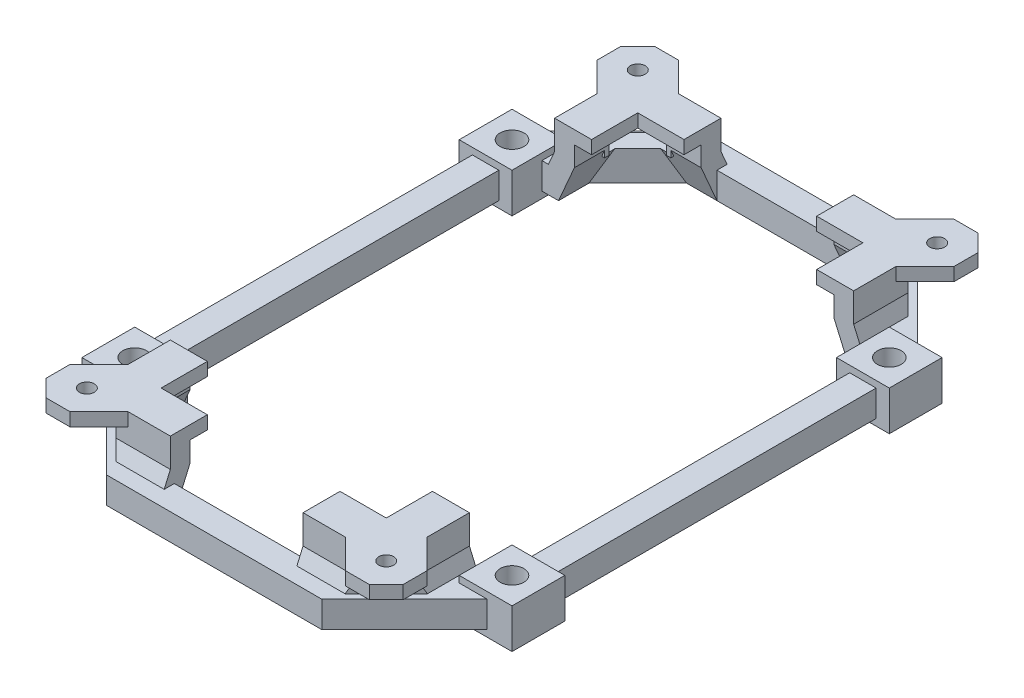
from build123d import *

# Parameters (mm, degrees)
BOSS_EXTRUDE1_DEPTH            = 8
BOSS_EXTRUDE2_DEPTH            = 2
BOSS_EXTRUDE3_DEPTH            = 9.05
SKETCH4_R                      = 2.25
BOSS_EXTRUDE4_DEPTH            = 4
CUT_EXTRUDE1_REACH             = 89.395
SKETCH5_W                      = 12.364675298
SKETCH5_H                      = 8
CUT_EXTRUDE1_DIRECTION_2_DEPTH = 88.395228364
CUT_EXTRUDE2_DEPTH             = 9.171573
CUT_EXTRUDE3_REACH             = 115.505
SKETCH8_W                      = 3.39411255
SKETCH8_H                      = 9.05
CUT_EXTRUDE3_DIRECTION_2_REACH = 115.505
BOSS_EXTRUDE5_DEPTH            = 16.456854
CUT_EXTRUDE4_DEPTH             = 114.504844196
SKETCH12_R                     = 3.6
CUT_EXTRUDE5_DEPTH             = 114.645358602
BOSS_EXTRUDE6_START            = 2
SKETCH13_W                     = 16
SKETCH13_H                     = 16
SKETCH13_R                     = 3.6
BOSS_EXTRUDE6_DEPTH            = 2
CUT_EXTRUDE6_REACH             = 182.475
CUT_EXTRUDE6_DIRECTION_2_DEPTH = 15


with BuildPart() as part:
    # Sketch1 → Boss-Extrude1 (new body)
    with BuildSketch(Plane(origin=(0, 0, 0), x_dir=(1, 0, 0), z_dir=(0, 1, 0))):
        Polygon((-53.15, 0), (-61.15, 0), (-61.15, -49.15), (-65.15, -49.15), (-65.15, -65.15), (-57.635281374, -65.15), (-32.585281374, -90.2), (0, -90.2), (0, -82.2), (-20.1, -82.2), (-20.1, -77.4), (-34.071572875, -77.4), (-39.3, -72.171572875), (-39.3, -58.2), (-49.15, -58.2), (-49.15, -49.15), (-53.15, -49.15), align=None)
    extrude(amount=BOSS_EXTRUDE1_DEPTH)

    # Sketch2 → Boss-Extrude2 (add)
    with BuildSketch(Plane.XZ):
        Polygon((-49.15, 58.2), (-49.15, 49.15), (-65.15, 49.15), (-65.15, 65.15), (-49.15, 65.15), align=None)
    extrude(amount=BOSS_EXTRUDE2_DEPTH)

    # Sketch3 → Boss-Extrude3 (add)
    with BuildSketch(Plane(origin=(0, 8, 0), x_dir=(1, 0, 0), z_dir=(0, 1, 0))):
        Polygon((-39.3, -58.2), (-45.3, -58.2), (-45.3, -74.656854249), (-36.556854249, -83.4), (-20.1, -83.4), (-20.1, -77.4), (-34.071572875, -77.4), (-39.3, -72.171572875), align=None)
    extrude(amount=BOSS_EXTRUDE3_DEPTH)

    # Sketch4 → Boss-Extrude4 (add)
    with BuildSketch(Plane(origin=(0, 17.05, 0), x_dir=(1, 0, 0), z_dir=(0, 1, 0))):
        Polygon((-45.3, -58.2), (-34.1, -58.2), (-34.1, -72.2), (-20.1, -72.2), (-20.1, -83.4), (-32.925631329, -83.4), (-41.723475836, -92.197844507), (-48.972213178, -92.197844507), (-54.097844507, -87.072213178), (-54.097844507, -79.823475836), (-45.3, -71.025631329), align=None)
        with Locations(Location((-45.347844507, -83.447844507, 0), (0, 0, 270))):
            Circle(SKETCH4_R, mode=Mode.SUBTRACT)
    extrude(amount=BOSS_EXTRUDE4_DEPTH)

    # Sketch5 → Cut-Extrude1 (cut, up to next)
    with BuildSketch(Plane(origin=(-59.978427125, 0, 59.978427125), x_dir=(0.7071067811865475, 0, 0.7071067811865477), z_dir=(-0.7071067811865477, 0, 0.7071067811865475)), mode=Mode.PRIVATE) as cut_extrude1_sk1:
        with Locations((26.940768363, 13.05)):
            Rectangle(SKETCH5_W, SKETCH5_H)
    cut_extrude1_tool1 = extrude(cut_extrude1_sk1.sketch, amount=-CUT_EXTRUDE1_REACH, mode=Mode.PRIVATE) & part.part
    add(cut_extrude1_tool1.solids().sort_by_distance((-40.928427, 13.05, 79.028427))[0], mode=Mode.SUBTRACT)

    # Sketch5 → Cut-Extrude1 direction 2 (cut)
    with BuildSketch(Plane(origin=(-59.978427125, 0, 59.978427125), x_dir=(0.7071067811865475, 0, 0.7071067811865477), z_dir=(-0.7071067811865477, 0, 0.7071067811865475))):
        with Locations((26.940768363, 13.05)):
            Rectangle(SKETCH5_W, SKETCH5_H)
    extrude(amount=CUT_EXTRUDE1_DIRECTION_2_DEPTH, mode=Mode.SUBTRACT)

    # Sketch6 → Cut-Extrude2 (cut)
    with BuildSketch(Plane(origin=(-20.1, 0, 0), x_dir=(0, 0, -1), z_dir=(1, 0, 0))):
        Polygon((-82.2, 0), (-77.4, 11.05), (-77.4, 0), align=None)
    cut_extrude2 = extrude(amount=-CUT_EXTRUDE2_DEPTH, mode=Mode.SUBTRACT)

    # Mirror1: Cut-Extrude2 across plane
    add(cut_extrude2.mirror(Plane(origin=(19.05, 0, 19.05), x_dir=(-0.7071067811865477, 0, 0.7071067811865474), z_dir=(0.7071067811865476, 0, 0.7071067811865476))), mode=Mode.SUBTRACT)

    # Cut-Extrude3: up to this face of the body (flat: up to its plane)
    cut_extrude3_end = Plane(part.part.faces().sort_by_distance((-41.7, 5.525, 62.7857865))[0])
    # Sketch8 → Cut-Extrude3 (cut, up to the picked face)
    with BuildSketch(Plane(origin=(19.05, 0, 19.05), x_dir=(0.7071067811865476, 0, -0.7071067811865476), z_dir=(0.7071067811865476, 0, 0.7071067811865476)), mode=Mode.PRIVATE) as cut_extrude3_sk1:
        with Locations((-77.125248815, 4.525)):
            Rectangle(SKETCH8_W, SKETCH8_H)
    cut_extrude3_tool1 = split(extrude(cut_extrude3_sk1.sketch, amount=-CUT_EXTRUDE3_REACH, mode=Mode.PRIVATE), bisect_by=cut_extrude3_end, keep=Keep.BOTH, mode=Mode.PRIVATE)
    add(cut_extrude3_tool1.solids().sort_by(Axis((-35.485786, 4.525, 73.585786), (-0.7071067811865476, 0, -0.7071067811865476)))[0], mode=Mode.SUBTRACT)

    # Cut-Extrude3 direction 2: up to this face of the body (flat: up to its plane)
    cut_extrude3_direction_2_end = Plane(part.part.faces().sort_by_distance((-24.6857865, 5.525, 79.8))[0])
    # Sketch8 → Cut-Extrude3 direction 2 (cut, up to the picked face)
    with BuildSketch(Plane(origin=(19.05, 0, 19.05), x_dir=(0.7071067811865476, 0, -0.7071067811865476), z_dir=(0.7071067811865476, 0, 0.7071067811865476)), mode=Mode.PRIVATE) as cut_extrude3_direction_2_sk1:
        with Locations((-77.125248815, 4.525)):
            Rectangle(SKETCH8_W, SKETCH8_H)
    cut_extrude3_direction_2_tool1 = split(extrude(cut_extrude3_direction_2_sk1.sketch, amount=CUT_EXTRUDE3_DIRECTION_2_REACH, mode=Mode.PRIVATE), bisect_by=cut_extrude3_direction_2_end, keep=Keep.BOTH, mode=Mode.PRIVATE)
    add(cut_extrude3_direction_2_tool1.solids().sort_by(Axis((-35.485786, 4.525, 73.585786), (0.7071067811865476, 0, 0.7071067811865476)))[0], mode=Mode.SUBTRACT)

    # Sketch10 → Boss-Extrude5 (add)
    with BuildSketch(Plane(origin=(-20.1, 0, 0), x_dir=(0, 0, -1), z_dir=(1, 0, 0))):
        Polygon((-83.4, 12.296887645), (-85.26652133, 8), (-83.4, 8), align=None)
    boss_extrude5 = extrude(amount=-BOSS_EXTRUDE5_DEPTH)

    # Sketch11 → Cut-Extrude4 (cut, through all)
    with BuildSketch(Plane(origin=(19.05, 0, 19.05), x_dir=(0.7071067811865476, 0, -0.7071067811865476), z_dir=(0.7071067811865476, 0, 0.7071067811865476))):
        Polygon((-84.82230509, 12.296887645), (-86.142134979, 8), (-84.82230509, 8), align=None)
    cut_extrude4 = extrude(amount=CUT_EXTRUDE4_DEPTH, mode=Mode.SUBTRACT)

    # Mirror2: Boss-Extrude5, Cut-Extrude4 across plane
    add(boss_extrude5.mirror(Plane(origin=(19.05, 0, 19.05), x_dir=(-0.7071067811865477, 0, 0.7071067811865474), z_dir=(0.7071067811865476, 0, 0.7071067811865476))))
    add(cut_extrude4.mirror(Plane(origin=(19.05, 0, 19.05), x_dir=(-0.7071067811865477, 0, 0.7071067811865474), z_dir=(0.7071067811865476, 0, 0.7071067811865476))), mode=Mode.SUBTRACT)

    # Sketch12 → Cut-Extrude5 (cut, through all)
    with BuildSketch(Plane(origin=(0, 8, 0), x_dir=(1, 0, 0), z_dir=(0, 1, 0))):
        with Locations(Location((-57.15, -57.15, 0), (0, 0, 270))):
            Circle(SKETCH12_R)
    extrude(amount=-CUT_EXTRUDE5_DEPTH, mode=Mode.SUBTRACT)

    # Mirror3: part across plane


with BuildPart() as part_1:
    add(part.part)
    add(part.part.mirror(Plane(origin=(-53.15, 8, 0), x_dir=(1, 0, 0), z_dir=(0, 0, 1))))

    # Mirror4: part across plane


with BuildPart() as part_2:
    add(part_1.part)
    add(part_1.part.mirror(Plane(origin=(0, 8, -90.2), x_dir=(0, 0, 1), z_dir=(-1, 0, 0))))

    # Sketch13 → Boss-Extrude6 (add)
    # profile 1 of 4: a face of its own
    with BuildSketch(Plane(origin=(0, 8, 0), x_dir=(1, 0, 0), z_dir=(0, 1, 0)).offset(BOSS_EXTRUDE6_START)):
        with Locations((-57.15, 57.15)):
            Rectangle(SKETCH13_W, SKETCH13_H)
        with Locations(Location((-57.15, 57.15, 0), (0, 0, 90))):
            Circle(SKETCH13_R, mode=Mode.SUBTRACT)
    # profile 2 of 4: a face of its own
    with BuildSketch(Plane(origin=(0, 8, 0), x_dir=(1, 0, 0), z_dir=(0, 1, 0)).offset(BOSS_EXTRUDE6_START)):
        with Locations((-57.15, -57.15)):
            Rectangle(SKETCH13_W, SKETCH13_H)
        with Locations(Location((-57.15, -57.15, 0), (0, 0, 270))):
            Circle(SKETCH13_R, mode=Mode.SUBTRACT)
    # profile 3 of 4: a face of its own
    with BuildSketch(Plane(origin=(0, 8, 0), x_dir=(1, 0, 0), z_dir=(0, 1, 0)).offset(BOSS_EXTRUDE6_START)):
        with Locations((57.15, -57.15)):
            Rectangle(SKETCH13_W, SKETCH13_H)
        with Locations(Location((57.15, -57.15, 0), (0, 0, 270))):
            Circle(SKETCH13_R, mode=Mode.SUBTRACT)
    # profile 4 of 4: a face of its own
    with BuildSketch(Plane(origin=(0, 8, 0), x_dir=(1, 0, 0), z_dir=(0, 1, 0)).offset(BOSS_EXTRUDE6_START)):
        with Locations((57.15, 57.15)):
            Rectangle(SKETCH13_W, SKETCH13_H)
        with Locations(Location((57.15, 57.15, 0), (0, 0, 90))):
            Circle(SKETCH13_R, mode=Mode.SUBTRACT)
    extrude(amount=-BOSS_EXTRUDE6_DEPTH)

    # Cut-Extrude6: up to this face of the body (flat: up to its plane)
    cut_extrude6_end = Plane(part_2.part.faces().sort_by_distance((25.508916271, 13.892566464, 77.4))[0])
    # Sketch14 → Cut-Extrude6 (cut, up to the picked face)
    with BuildSketch(Plane(origin=(0, 0, 74.785786438), x_dir=(-1, 0, 0), z_dir=(0, 0, -1)), mode=Mode.PRIVATE) as cut_extrude6_sk1:
        with BuildLine():
            Line((-38.891815428, 9.05), (-29.271572875, 9.05))
            Line((-29.271572875, 9.05), (-29.271572875, 0))
            Line((-29.271572875, 0), (-37.428466034, 0))
            ThreePointArc((-37.428466034, 0), (-38.292196947, 4.503647029), (-38.891815428, 9.05))
        make_face()
    cut_extrude6_tool1 = split(extrude(cut_extrude6_sk1.sketch, amount=-CUT_EXTRUDE6_REACH, mode=Mode.PRIVATE), bisect_by=cut_extrude6_end, keep=Keep.BOTH, mode=Mode.PRIVATE)
    add(cut_extrude6_tool1.solids().sort_by(Axis((33.771048, 4.647825, 74.785786), (0, 0, 1)))[0], mode=Mode.SUBTRACT)

    # Sketch14 → Cut-Extrude6 direction 2 (cut)
    with BuildSketch(Plane(origin=(0, 0, 74.785786438), x_dir=(-1, 0, 0), z_dir=(0, 0, -1))):
        with BuildLine():
            Line((-38.891815428, 9.05), (-29.271572875, 9.05))
            Line((-29.271572875, 9.05), (-29.271572875, 0))
            Line((-29.271572875, 0), (-37.428466034, 0))
            ThreePointArc((-37.428466034, 0), (-38.292196947, 4.503647029), (-38.891815428, 9.05))
        make_face()
    extrude(amount=CUT_EXTRUDE6_DIRECTION_2_DEPTH, mode=Mode.SUBTRACT)


solid = part_2.part
